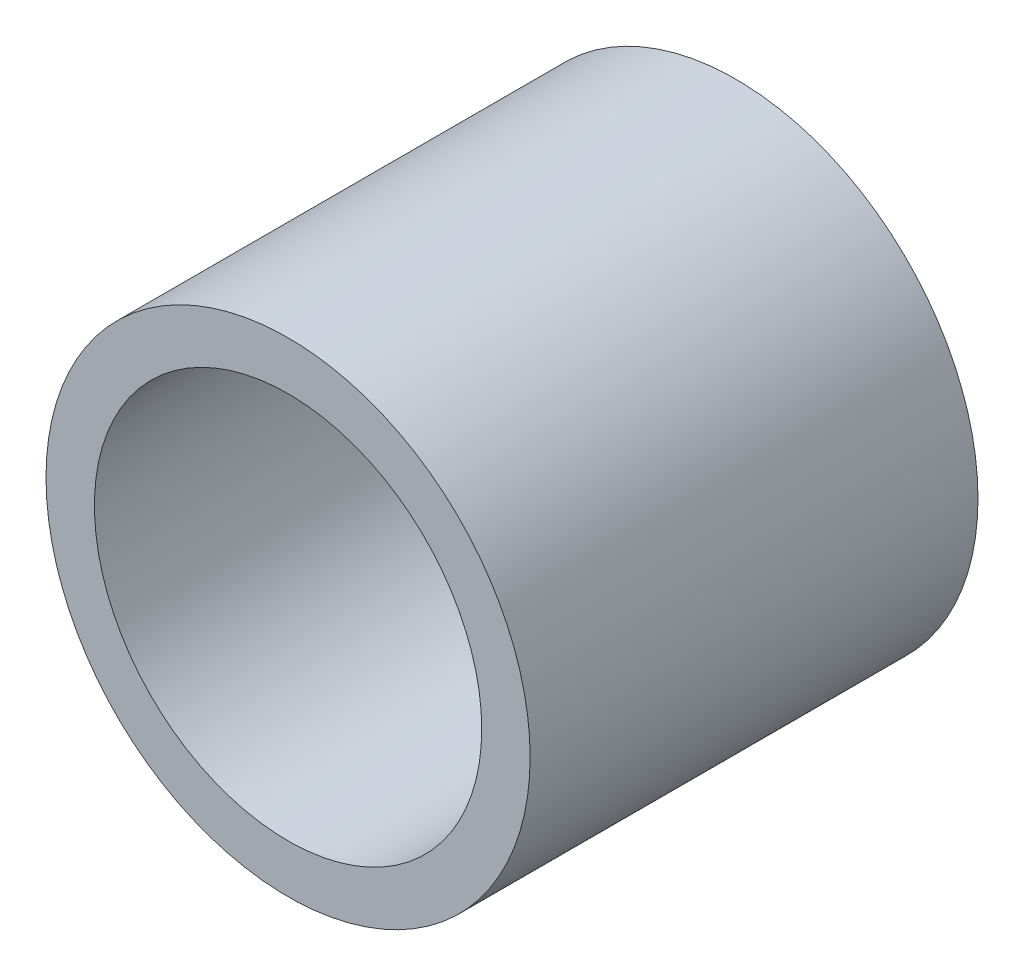
from build123d import *

# Parameters (mm, degrees)
SKETCH1_R           = 5
SKETCH1_R_2         = 4
EXTRUDE_THIN1_DEPTH = 9.25


with BuildPart() as part:
    # Sketch1 → Extrude-Thin1 (new body)
    with BuildSketch(Plane.XY):
        Circle(SKETCH1_R)
        Circle(SKETCH1_R_2, mode=Mode.SUBTRACT)
    extrude(amount=EXTRUDE_THIN1_DEPTH)


solid = part.part
